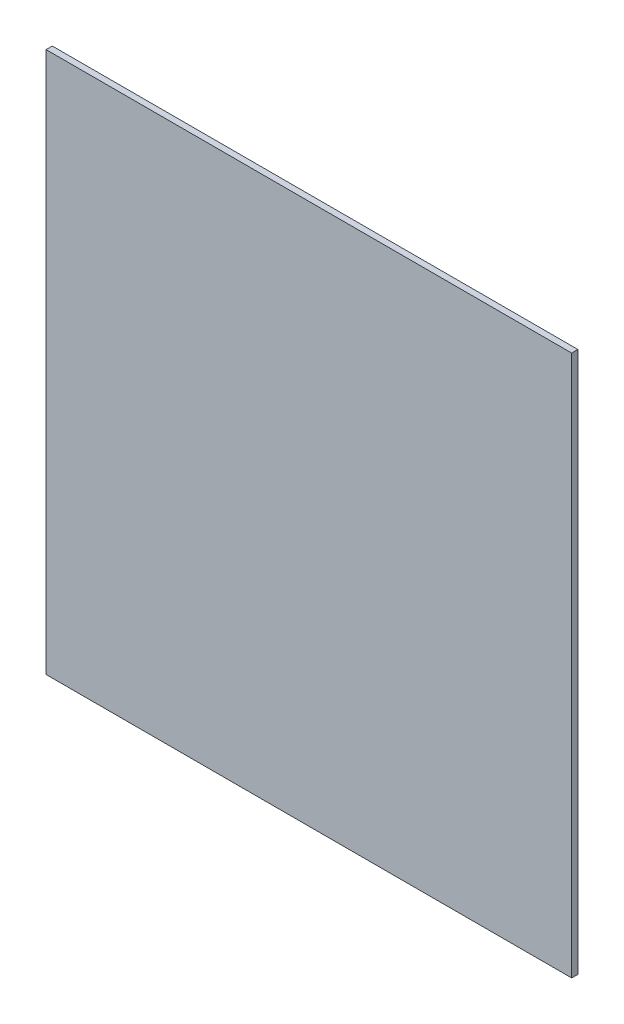
from build123d import *

# Parameters (mm, degrees)
ESQUISSE1_W        = 338
ESQUISSE1_H        = 348
BOSS_EXTRU_1_DEPTH = 4


with BuildPart() as part:
    # Esquisse1 → Boss.-Extru.1 (new body)
    with BuildSketch(Plane.XY):
        Rectangle(ESQUISSE1_W, ESQUISSE1_H)
    extrude(amount=BOSS_EXTRU_1_DEPTH)


solid = part.part
